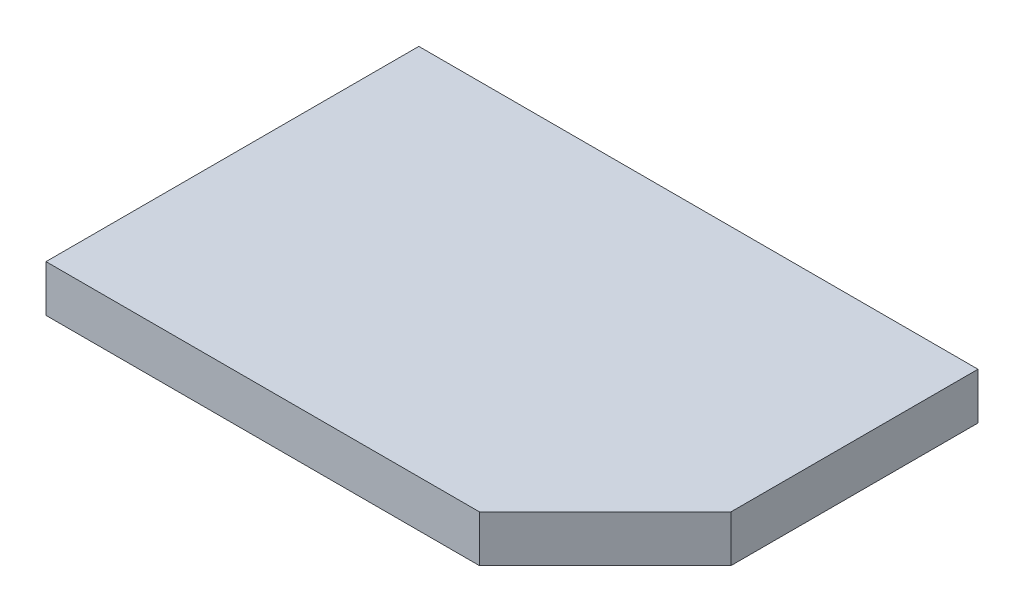
from build123d import *

# Parameters (mm, degrees)
ESBO_O1_W       = 1.2
ESBO_O1_H       = 0.8
EXTRUS_O1_DEPTH = 0.1
CHANFRO1_SIZE   = 0.27


with BuildPart() as part:
    # Esboço1 → Extrusão1 (new body)
    with BuildSketch(Plane(origin=(0, 0, 0), x_dir=(1, 0, 0), z_dir=(0, 1, 0))):
        Rectangle(ESBO_O1_W, ESBO_O1_H)
    extrude(amount=EXTRUS_O1_DEPTH)

    # Chanfro1
    chanfro1_edges = [part.edges().sort_by_distance(p)[0] for p in [
        (0.6, 0.05, 0.4),
    ]]
    chamfer(chanfro1_edges, length=CHANFRO1_SIZE)


solid = part.part
